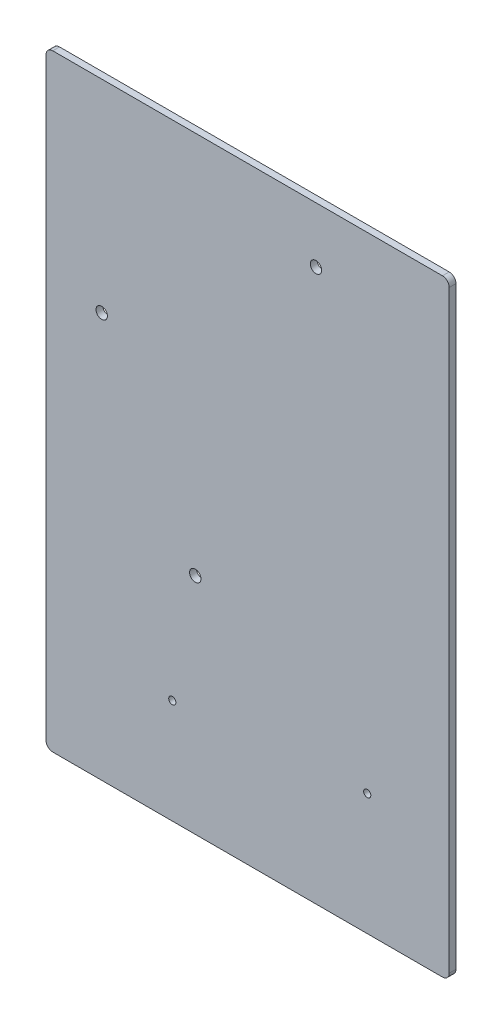
from build123d import *

# Parameters (mm, degrees)
BOSS_EXTRUDE1_DEPTH              = 6.35
FILLET1_R                        = 3.175
FILLET2_R                        = 44.45
F_1_4_CLEARANCE_HOLE1_D          = 6.7564
SKETCH4_W                        = 100.0125
SKETCH4_H                        = 155.575
CUT_EXTRUDE1_DEPTH               = 746.989881382
F_27_64_0_42188_DIAMETER_HOLE1_D = 10.715752
FILLET3_R                        = 6.35


with BuildPart() as part:
    # Sketch1 → Boss-Extrude1 (new body)
    with BuildSketch(Plane.XY):
        Polygon((0, 0), (0, 571.5), (379.4125, 571.5), (379.4125, 466.725), (479.425, 466.725), (479.425, 355.6), (428.625, 355.6), (428.625, 403.225), (379.4125, 403.225), (379.4125, 0), align=None)
    extrude(amount=BOSS_EXTRUDE1_DEPTH)

    # Fillet1
    fillet1_edges = [part.edges().sort_by_distance(p)[0] for p in [
        (428.625, 403.225, 3.175),
        (379.4125, 403.225, 3.175),
    ]]
    fillet(fillet1_edges, radius=FILLET1_R)

    # Fillet2
    fillet2_edges = [part.edges().sort_by_distance(p)[0] for p in [
        (379.4125, 466.725, 3.175),
        (479.425, 466.725, 3.175),
    ]]
    fillet(fillet2_edges, radius=FILLET2_R)

    # 1/4 Clearance Hole1 (through all)
    with Locations(Plane(origin=(0, 0, 0), x_dir=(-1, 0, 0), z_dir=(0, 0, -1))):
        with Locations((-118.810746346, 98.250269973), (-302.26, 114.3)):
            Hole(F_1_4_CLEARANCE_HOLE1_D / 2)

    # Sketch4 → Cut-Extrude1 (cut, through all)
    with BuildSketch(Plane(origin=(0, 0, 0), x_dir=(-1, 0, 0), z_dir=(0, 0, -1))):
        with Locations((-429.41875, 433.3875)):
            Rectangle(SKETCH4_W, SKETCH4_H)
    extrude(amount=-CUT_EXTRUDE1_DEPTH, mode=Mode.SUBTRACT)

    # 27/64 (0.42188) Diameter Hole1 (through all)
    with Locations(Plane(origin=(0, 0, 0), x_dir=(-1, 0, 0), z_dir=(0, 0, -1))):
        with Locations((-254, 519.1125), (-52.3875, 381), (-140.462, 210.82)):
            Hole(F_27_64_0_42188_DIAMETER_HOLE1_D / 2)

    # Fillet3
    fillet3_edges = [part.edges().sort_by_distance(p)[0] for p in [
        (0, 0, 3.175),
        (0, 571.5, 3.175),
        (379.4125, 571.5, 3.175),
        (379.4125, 0, 3.175),
    ]]
    fillet(fillet3_edges, radius=FILLET3_R)


solid = part.part
